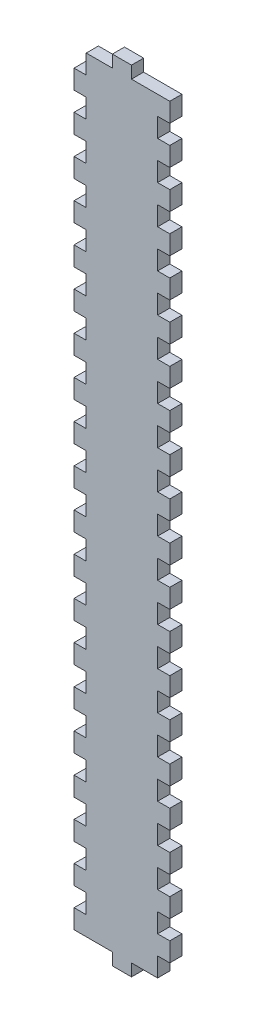
from build123d import *

# Parameters (mm, degrees)
SKETCH1_W           = 37.3
SKETCH1_H           = 400
BOSS_EXTRUDE1_DEPTH = 6.35
SKETCH10_W          = 6.35
SKETCH10_H          = 10
BOSS_EXTRUDE3_DEPTH = 6.35
SKETCH11_W          = 6.35
SKETCH11_H          = 10
BOSS_EXTRUDE4_DEPTH = 6.35
LPATTERN5_COUNT     = 20
LPATTERN5_PITCH     = 20
SKETCH12_W          = 10
SKETCH12_H          = 6.35
BOSS_EXTRUDE5_DEPTH = 6.35


with BuildPart() as part:
    # Sketch1 → Boss-Extrude1 (new body)
    with BuildSketch(Plane.XY):
        Rectangle(SKETCH1_W, SKETCH1_H)
    extrude(amount=BOSS_EXTRUDE1_DEPTH)

    # Sketch10 → Boss-Extrude3 (add)
    with BuildSketch(Plane.XY):
        with Locations((-21.825, -195)):
            Rectangle(SKETCH10_W, SKETCH10_H)
    boss_extrude3 = extrude(amount=BOSS_EXTRUDE3_DEPTH)

    # Sketch11 → Boss-Extrude4 (add)
    with BuildSketch(Plane.XY):
        with Locations((21.825, -185)):
            Rectangle(SKETCH11_W, SKETCH11_H)
    boss_extrude4 = extrude(amount=BOSS_EXTRUDE4_DEPTH)

    # LPattern5: Boss-Extrude3, Boss-Extrude4 ×20
    with Locations(*[(0, i * LPATTERN5_PITCH, 0) for i in range(1, LPATTERN5_COUNT)]):
        add(boss_extrude3)
        add(boss_extrude4)

    # Sketch12 → Boss-Extrude5 (add)
    with BuildSketch(Plane.XY):
        with Locations((0, 203.175)):
            Rectangle(SKETCH12_W, SKETCH12_H)
    boss_extrude5 = extrude(amount=BOSS_EXTRUDE5_DEPTH)

    # Mirror1: Boss-Extrude5 across plane
    add(boss_extrude5.mirror(Plane.ZX))


solid = part.part
